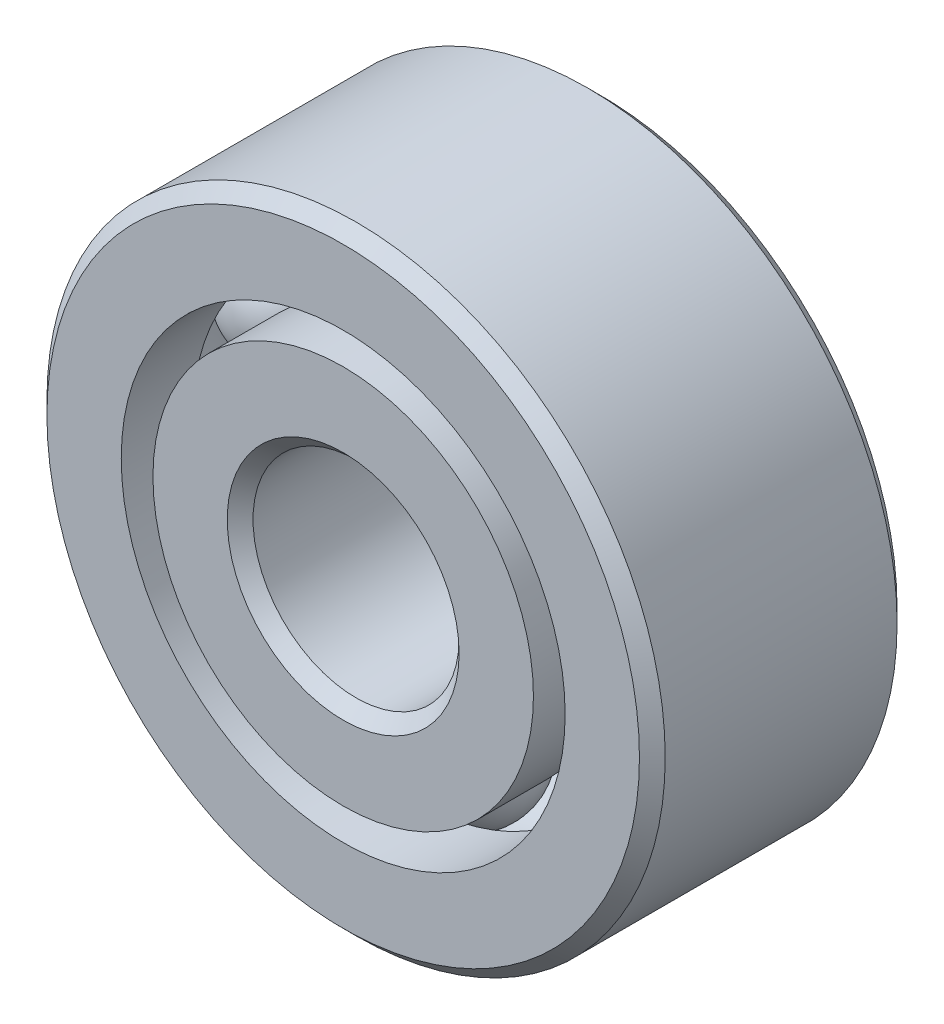
from build123d import *

# Parameters (mm, degrees)
CIRPATTERN1_COUNT = 6


with BuildPart() as part:
    # Sketch1 → Revolve1 (revolve)
    with BuildSketch(Plane(origin=(0, 0, 0), x_dir=(0, 0, -1), z_dir=(1, 0, 0))):
        with BuildLine():
            Line((1.7859375, 4.7625), (-1.7859375, 4.7625))
            Line((-1.7859375, 4.7625), (-1.984375, 4.5640625))
            Line((-1.984375, 4.5640625), (-1.984375, 3.419230769))
            Line((-1.984375, 3.419230769), (-0.881944444, 3.419230769))
            ThreePointArc((-0.881944444, 3.419230769), (0, 4.090136422), (0.881944444, 3.419230769))
            Line((0.881944444, 3.419230769), (1.984375, 3.419230769))
            Line((1.984375, 3.419230769), (1.984375, 4.5640625))
            Line((1.984375, 4.5640625), (1.7859375, 4.7625))
        make_face()
    revolve(axis=Axis((0, 0, 1.984375), (0, 0, -1)))


with BuildPart() as body_2:
    # Sketch3 → Revolve3 (revolve)
    with BuildSketch(Plane(origin=(0, 0, 0), x_dir=(0, 0, -1), z_dir=(1, 0, 0))):
        with BuildLine():
            Line((-1.984375, 2.930769231), (-0.881944444, 2.930769231))
            ThreePointArc((-0.881944444, 2.930769231), (0, 2.259863578), (0.881944444, 2.930769231))
            Line((0.881944444, 2.930769231), (1.984375, 2.930769231))
            Line((1.984375, 2.930769231), (1.984375, 1.7859375))
            Line((1.984375, 1.7859375), (1.7859375, 1.5875))
            Line((1.7859375, 1.5875), (-1.7859375, 1.5875))
            Line((-1.7859375, 1.5875), (-1.984375, 1.7859375))
            Line((-1.984375, 1.7859375), (-1.984375, 2.930769231))
        make_face()
    revolve(axis=Axis((0, 0, 1.984375), (0, 0, -1)))


with BuildPart() as body_3:
    # Sketch4 → Revolve4 (revolve)
    with BuildSketch(Plane(origin=(0, 0, 0), x_dir=(0, 0, -1), z_dir=(1, 0, 0))):
        with BuildLine():
            Line((-0.915136422, 3.175), (0.915136422, 3.175))
            ThreePointArc((0.915136422, 3.175), (0, 4.090136422), (-0.915136422, 3.175))
        make_face()
    revolve(axis=Axis((0, 3.175, 0.915136422), (0, 0, -1)))


with BuildPart() as cirpattern1_1:
    # CirPattern1: pattern copy
    add(body_3.part.rotate(Axis((0, 0, -1.984375), (0, 0, 1)), 1 * 360 / CIRPATTERN1_COUNT))


with BuildPart() as cirpattern1_2:
    # CirPattern1: pattern copy
    add(body_3.part.rotate(Axis((0, 0, -1.984375), (0, 0, 1)), 2 * 360 / CIRPATTERN1_COUNT))


with BuildPart() as cirpattern1_3:
    # CirPattern1: pattern copy
    add(body_3.part.rotate(Axis((0, 0, -1.984375), (0, 0, 1)), 3 * 360 / CIRPATTERN1_COUNT))


with BuildPart() as cirpattern1_4:
    # CirPattern1: pattern copy
    add(body_3.part.rotate(Axis((0, 0, -1.984375), (0, 0, 1)), 4 * 360 / CIRPATTERN1_COUNT))


with BuildPart() as cirpattern1_5:
    # CirPattern1: pattern copy
    add(body_3.part.rotate(Axis((0, 0, -1.984375), (0, 0, 1)), 5 * 360 / CIRPATTERN1_COUNT))


solid = Compound([part.part, body_2.part, body_3.part, cirpattern1_1.part, cirpattern1_2.part, cirpattern1_3.part, cirpattern1_4.part, cirpattern1_5.part])
